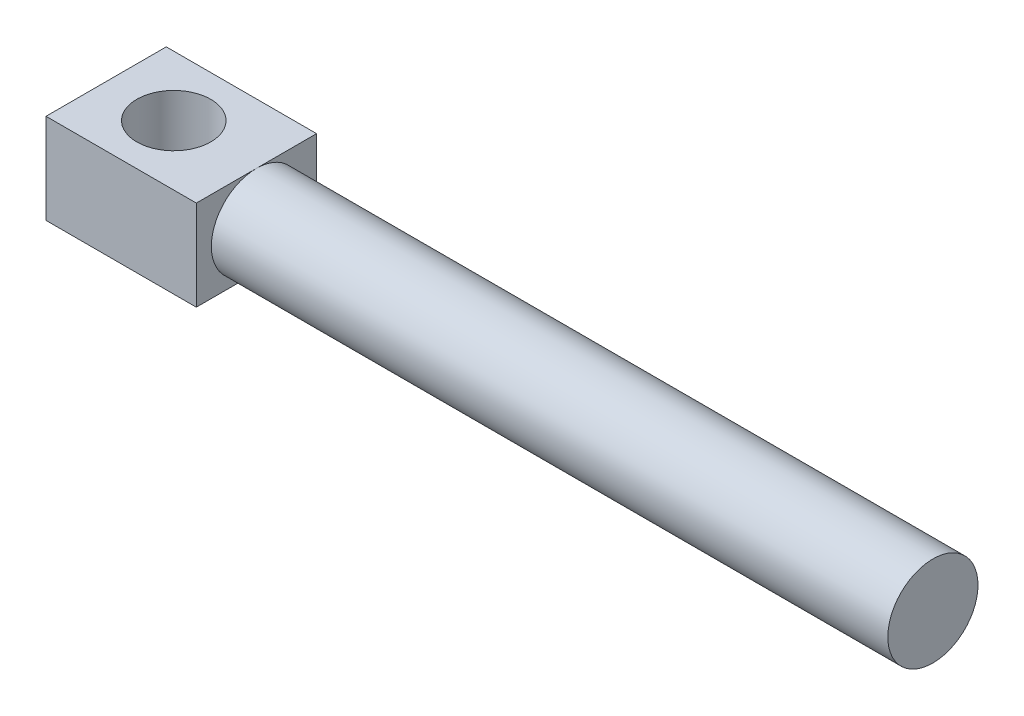
from build123d import *

# Parameters (mm, degrees)
SKETCH_1_W          = 10
SKETCH_1_H          = 8
EXTRUDE_1_DEPTH     = 6
EXTRUDE_2_DEPTH     = 45
CUT_EXTRUDE_1_REACH = 52.517
SKETCH_3_R          = 2.46


with BuildPart() as part:
    # 草图1 → 凸台-拉伸1 (new body)
    with BuildSketch(Plane(origin=(0, 0, 0), x_dir=(1, 0, 0), z_dir=(0, 1, 0))):
        Rectangle(SKETCH_1_W, SKETCH_1_H)
    extrude(amount=EXTRUDE_1_DEPTH)

    # 草图2 → 凸台-拉伸2 (add)
    with BuildSketch(Plane(origin=(5, 0, 0), x_dir=(0, 0, -1), z_dir=(1, 0, 0))):
        with BuildLine():
            ThreePointArc((0, 6), (-3, 3), (0, 0))
            Line((0, 0), (0, 6))
        make_face()
        with BuildLine():
            Line((0, 6), (0, 0))
            ThreePointArc((0, 0), (2.121320344, 0.878679656), (3, 3))
            ThreePointArc((3, 3), (2.121320344, 5.121320344), (0, 6))
        make_face()
    extrude(amount=EXTRUDE_2_DEPTH)

    # 草图3 → 切除-拉伸1 (cut, up to next)
    with BuildSketch(Plane(origin=(0, 6, 0), x_dir=(1, 0, 0), z_dir=(0, 1, 0)), mode=Mode.PRIVATE) as cut_extrude_1_sk1:
        with Locations(Location((-0.5, 0, 0), (0, 0, 270))):
            Circle(SKETCH_3_R)
    cut_extrude_1_tool1 = extrude(cut_extrude_1_sk1.sketch, amount=-CUT_EXTRUDE_1_REACH, mode=Mode.PRIVATE) & part.part
    add(cut_extrude_1_tool1.solids().sort_by_distance((-0.5, 6, 0))[0], mode=Mode.SUBTRACT)


solid = part.part
